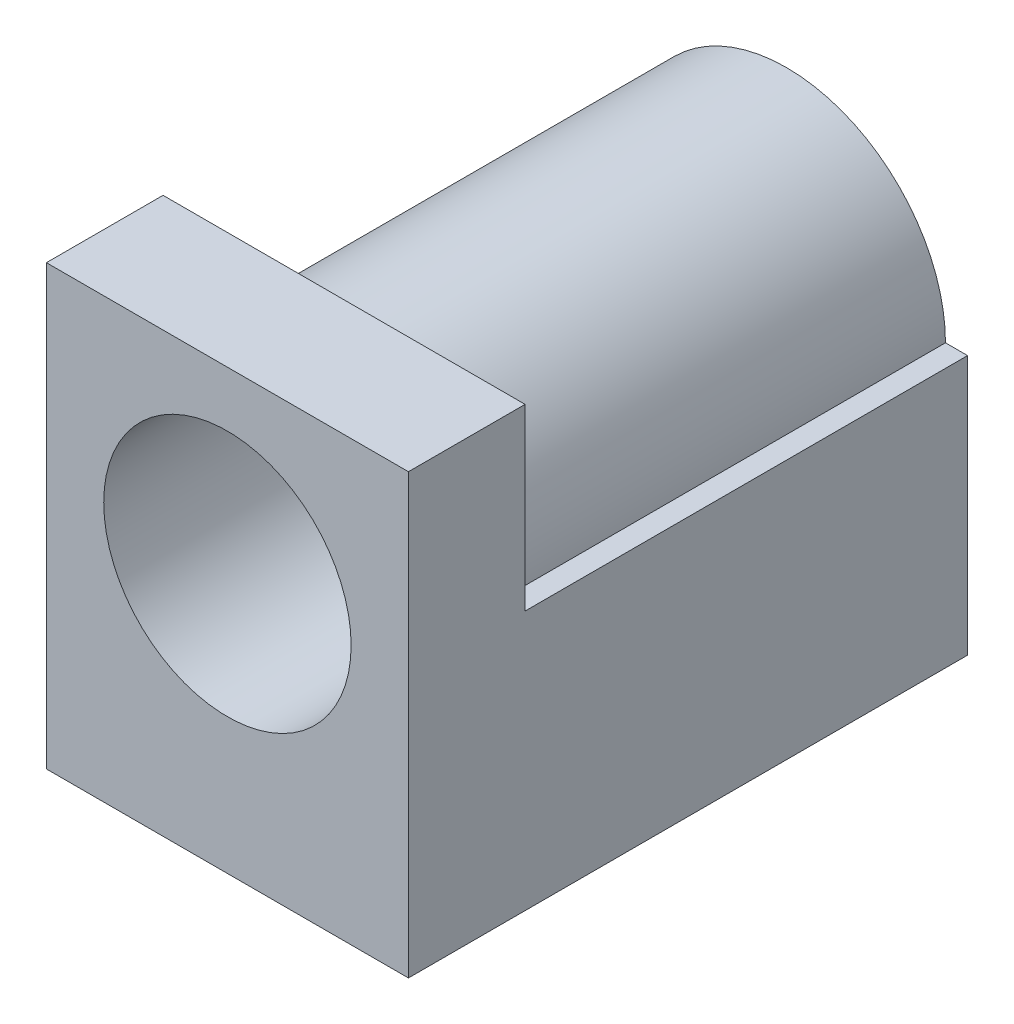
from build123d import *

# Parameters (mm, degrees)
SKETCH1_W           = 9
SKETCH1_H           = 10.9
BOSS_EXTRUDE1_DEPTH = 2.9
BOSS_EXTRUDE2_DEPTH = 11
SKETCH3_R           = 3.075
CUT_EXTRUDE1_DEPTH  = 9


with BuildPart() as part:
    # Sketch1 → Boss-Extrude1 (new body)
    with BuildSketch(Plane.XY):
        Rectangle(SKETCH1_W, SKETCH1_H)
    extrude(amount=BOSS_EXTRUDE1_DEPTH)

    # Sketch2 → Boss-Extrude2 (add)
    with BuildSketch(Plane(origin=(0, 0, 0), x_dir=(-1, 0, 0), z_dir=(0, 0, -1))):
        with BuildLine():
            Line((-3.95, 1), (-4.5, 1))
            Line((-4.5, 1), (-4.5, -5.45))
            Line((-4.5, -5.45), (4.5, -5.45))
            Line((4.5, -5.45), (4.5, 1))
            Line((4.5, 1), (3.95, 1))
            ThreePointArc((3.95, 1), (0, 4.95), (-3.95, 1))
        make_face()
    extrude(amount=BOSS_EXTRUDE2_DEPTH)

    # Sketch3 → Cut-Extrude1 (cut)
    with BuildSketch(Plane.XY.offset(2.9)):
        with Locations((0, 1)):
            Circle(SKETCH3_R)
    extrude(amount=-CUT_EXTRUDE1_DEPTH, mode=Mode.SUBTRACT)


solid = part.part
